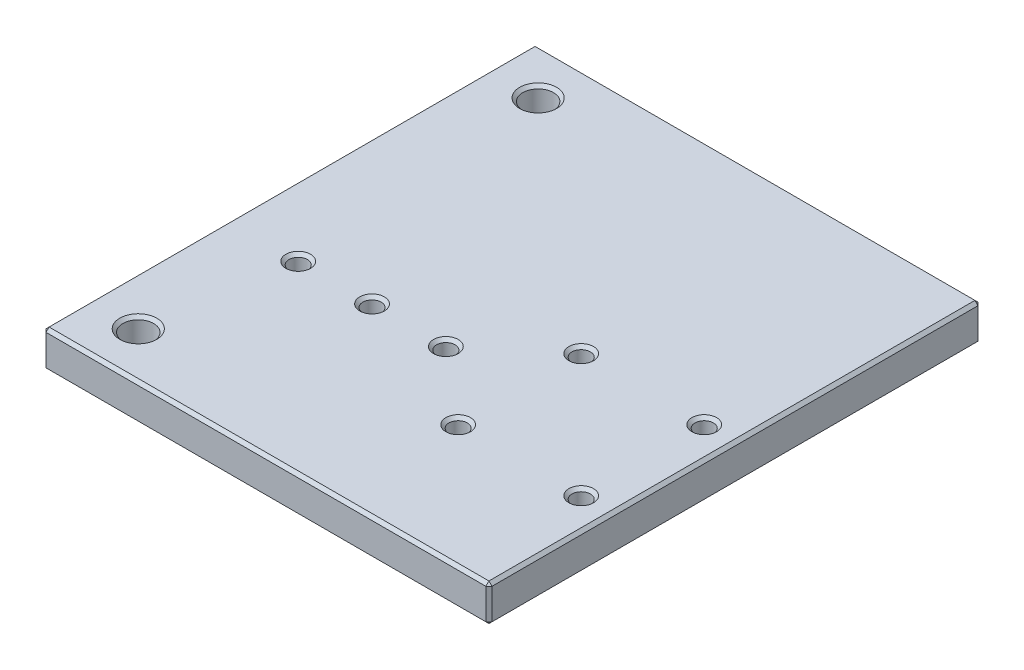
from build123d import *

# Parameters (mm, degrees)
CROQUIS1_W              = 72.5
CROQUIS1_H              = 80
CROQUIS1_R              = 1.5
CROQUIS1_R_2            = 2.5
SALIENTE_EXTRUIR1_DEPTH = 6
CHAFL_N1_SIZE           = 0.5


with BuildPart() as part:
    # Croquis1 → Saliente-Extruir1 (new body)
    with BuildSketch(Plane(origin=(0, 0, 0), x_dir=(1, 0, 0), z_dir=(0, 1, 0))):
        with Locations((5.730956658, -13.721461187)):
            Rectangle(CROQUIS1_W, CROQUIS1_H)
        with Locations(Location((16.980956658, -13.721461187, 0), (0, 0, 270))):
            Circle(CROQUIS1_R, mode=Mode.SUBTRACT)
        with Locations(Location((36.980956658, -13.721461187, 0), (0, 0, 270))):
            Circle(CROQUIS1_R, mode=Mode.SUBTRACT)
        with Locations(Location((16.980956658, -33.721461187, 0), (0, 0, 270))):
            Circle(CROQUIS1_R, mode=Mode.SUBTRACT)
        with Locations(Location((36.980956658, -33.721461187, 0), (0, 0, 270))):
            Circle(CROQUIS1_R, mode=Mode.SUBTRACT)
        with Locations(Location((-7.019043342, -23.721461187, 0), (0, 0, 270))):
            Circle(CROQUIS1_R, mode=Mode.SUBTRACT)
        with Locations(Location((4.980956658, -23.721461187, 0), (0, 0, 270))):
            Circle(CROQUIS1_R, mode=Mode.SUBTRACT)
        with Locations(Location((-22.519043342, 18.778538813, 0), (0, 0, 270))):
            Circle(CROQUIS1_R_2, mode=Mode.SUBTRACT)
        with Locations(Location((-22.519043342, -46.221461187, 0), (0, 0, 270))):
            Circle(CROQUIS1_R_2, mode=Mode.SUBTRACT)
        with Locations(Location((-19.019043342, -23.721461187, 0), (0, 0, 270))):
            Circle(CROQUIS1_R, mode=Mode.SUBTRACT)
    extrude(amount=SALIENTE_EXTRUIR1_DEPTH)

    # Chaflán1
    chafl_n1_edges = [part.edges().sort_by_distance(p)[0] for p in [
        (41.980956658, 6, 13.721461187),
        (16.980956658, 0, 12.221461187),
        (16.980956658, 6, 12.221461187),
        (5.730956658, 6, -26.278538813),
        (36.980956658, 0, 12.221461187),
        (36.980956658, 6, 12.221461187),
        (16.980956658, 0, 32.221461187),
        (16.980956658, 6, 32.221461187),
        (36.980956658, 0, 32.221461187),
        (36.980956658, 6, 32.221461187),
        (-7.019043342, 0, 22.221461187),
        (-7.019043342, 6, 22.221461187),
        (4.980956658, 0, 22.221461187),
        (4.980956658, 6, 22.221461187),
        (-22.519043342, 0, -21.278538813),
        (-22.519043342, 6, -21.278538813),
        (-22.519043342, 0, 43.721461187),
        (-22.519043342, 6, 43.721461187),
        (-30.519043342, 6, 13.721461187),
        (-19.019043342, 0, 22.221461187),
        (-19.019043342, 6, 22.221461187),
        (5.730956658, 0, -26.278538813),
        (41.980956658, 0, 13.721461187),
        (5.730956658, 0, 53.721461187),
        (-30.519043342, 0, 13.721461187),
        (5.730956658, 6, 53.721461187),
        (-30.519043342, 3, -26.278538813),
        (41.980956658, 3, -26.278538813),
        (41.980956658, 3, 53.721461187),
        (-30.519043342, 3, 53.721461187),
    ]]
    chamfer(chafl_n1_edges, length=CHAFL_N1_SIZE)


solid = part.part
